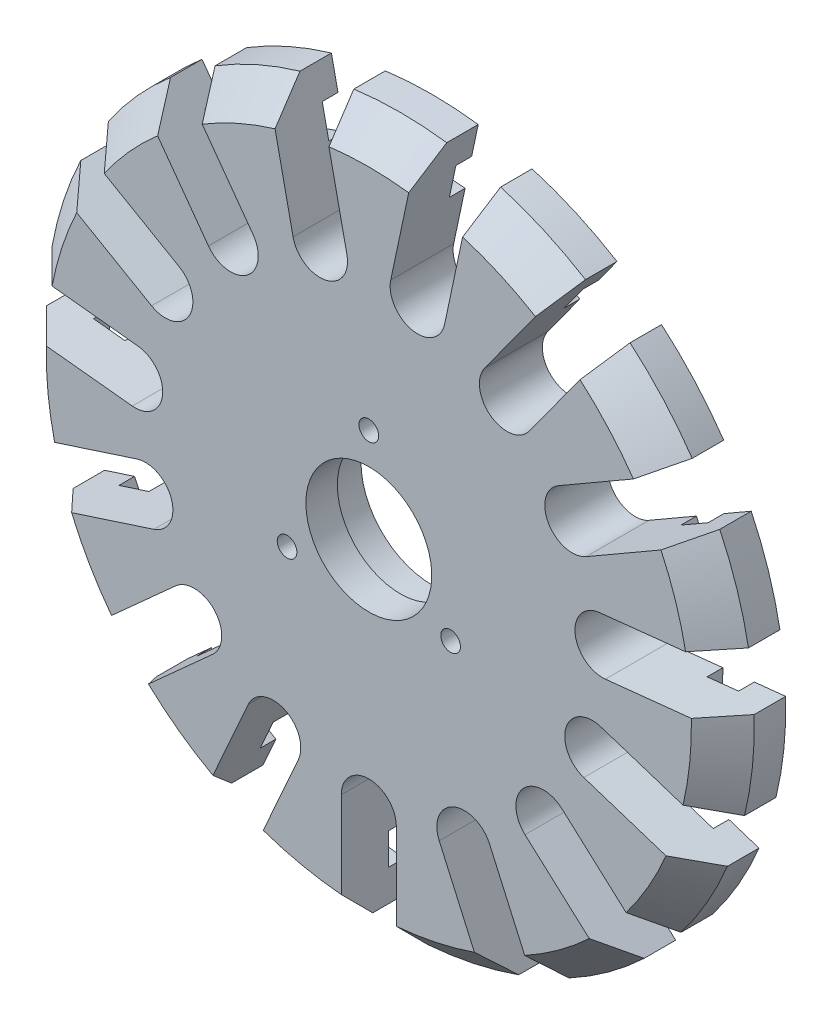
from build123d import *

# Parameters (mm, degrees)
ESBO_O1_R                = 22.5
RESSALTO_EXTRUS_O1_DEPTH = 4
CHANFRO1_SIZE            = 2
CORTE_EXTRUS_O1_DEPTH    = 33.070235422
ESBO_O3_R                = 4
CORTE_EXTRUS_O2_DEPTH    = 33.070235422
ESBO_O4_R                = 4.5
CORTE_EXTRUS_O3_DEPTH    = 2
PADR_OCIRCULAR1_COUNT    = 15
ESBO_O5_R                = 20.5
ESBO_O5_R_2              = 18.5
CORTE_EXTRUS_O4_DEPTH    = 1
FURO_ROSCADO_DE_M1_61_D  = 1.25
PADR_OCIRCULAR2_COUNT    = 3


with BuildPart() as part:
    # Esboço1 → Ressalto-extrusão1 (new body)
    with BuildSketch(Plane.XY):
        Circle(ESBO_O1_R)
    extrude(amount=RESSALTO_EXTRUS_O1_DEPTH)

    # Chanfro1
    chanfro1_edges = [part.edges().sort_by_distance(p)[0] for p in [
        (-22.5, 0, 4),
    ]]
    chamfer(chanfro1_edges, length=CHANFRO1_SIZE)

    # Esboço2 → Corte-extrusão1 (cut, through all)
    with BuildSketch(Plane(origin=(0, 0, 0), x_dir=(-1, 0, 0), z_dir=(0, 0, -1))):
        with BuildLine():
            Line((1.75, -22.431841208), (1.75, -14.931841208))
            ThreePointArc((1.75, -14.931841208), (0, -13.181841208), (-1.75, -14.931841208))
            Line((-1.75, -14.931841208), (-1.75, -22.431841208))
            ThreePointArc((-1.75, -22.431841208), (0, -22.5), (1.75, -22.431841208))
        make_face()
    corte_extrus_o1 = extrude(amount=-CORTE_EXTRUS_O1_DEPTH, mode=Mode.SUBTRACT)

    # Esboço3 → Corte-extrusão2 (cut, through all)
    with BuildSketch(Plane(origin=(0, 0, 0), x_dir=(-1, 0, 0), z_dir=(0, 0, -1))):
        Circle(ESBO_O3_R)
    extrude(amount=-CORTE_EXTRUS_O2_DEPTH, mode=Mode.SUBTRACT)

    # Esboço4 → Corte-extrusão3 (cut)
    with BuildSketch(Plane(origin=(0, 0, 0), x_dir=(-1, 0, 0), z_dir=(0, 0, -1))):
        Circle(ESBO_O4_R)
    extrude(amount=-CORTE_EXTRUS_O3_DEPTH, mode=Mode.SUBTRACT)

    # PadrãoCircular1: Corte-extrusão1 ×15 about axis
    padr_ocircular1_axis = Axis((0, 0, 0), (0, 0, 1))
    for i in range(1, PADR_OCIRCULAR1_COUNT):
        add(corte_extrus_o1.rotate(padr_ocircular1_axis, i * 360 / PADR_OCIRCULAR1_COUNT), mode=Mode.SUBTRACT)

    # Esboço5 → Corte-extrusão4 (cut)
    with BuildSketch(Plane(origin=(0, 0, 0), x_dir=(-1, 0, 0), z_dir=(0, 0, -1))):
        Circle(ESBO_O5_R)
        Circle(ESBO_O5_R_2, mode=Mode.SUBTRACT)
    extrude(amount=-CORTE_EXTRUS_O4_DEPTH, mode=Mode.SUBTRACT)

    # Furo roscado de M1.61 (through all)
    with Locations(Plane(origin=(0, 6, 0), x_dir=(-1, 0, 0), z_dir=(0, 0, -1))):
        with Locations((0, 0)):
            furo_roscado_de_m1_61 = Hole(FURO_ROSCADO_DE_M1_61_D / 2)

    # PadrãoCircular2: Furo roscado de M1.61 ×3 about axis
    padr_ocircular2_axis = Axis((0, 0, 0), (0, 0, 1))
    for i in range(1, PADR_OCIRCULAR2_COUNT):
        add(furo_roscado_de_m1_61.rotate(padr_ocircular2_axis, i * 360 / PADR_OCIRCULAR2_COUNT), mode=Mode.SUBTRACT)


solid = part.part
